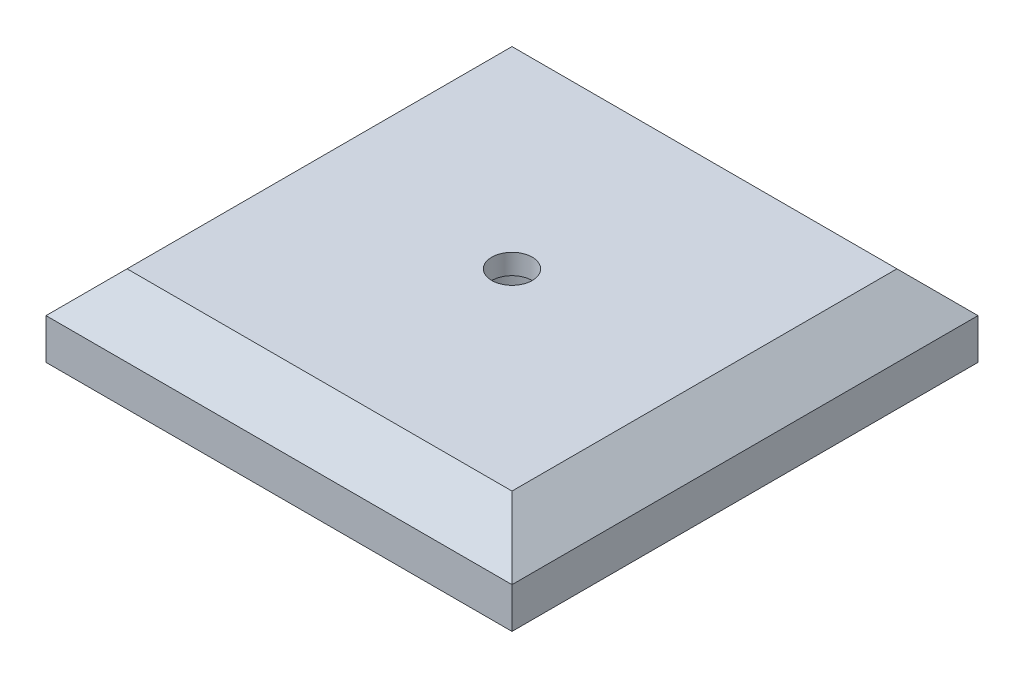
from build123d import *

# Parameters (mm, degrees)
SKETCH1_W           = 2.875
SKETCH1_H           = 2.875
BOSS_EXTRUDE1_DEPTH = 0.5
SKETCH4_R           = 0.252718066
CUT_EXTRUDE2_DEPTH  = 0.375
SKETCH6_R           = 0.125
CUT_EXTRUDE3_DEPTH  = 0.125
CHAMFER1_SIZE       = 0.25
CHAMFER2_SIZE       = 0.25
CHAMFER3_SIZE       = 0.25
CHAMFER4_SIZE       = 0.25


with BuildPart() as part:
    # Sketch1 → Boss-Extrude1 (new body)
    with BuildSketch(Plane(origin=(0, 0, 0), x_dir=(1, 0, 0), z_dir=(0, 1, 0))):
        Rectangle(SKETCH1_W, SKETCH1_H)
    extrude(amount=BOSS_EXTRUDE1_DEPTH)

    # Sketch4 → Cut-Extrude2 (cut)
    with BuildSketch(Plane(origin=(0, 0, 0), x_dir=(1, 0, 0), z_dir=(0, 1, 0))):
        with Locations(Location((0, 0, 0), (0, 0, 270))):
            Circle(SKETCH4_R)
    extrude(amount=CUT_EXTRUDE2_DEPTH, mode=Mode.SUBTRACT)

    # Sketch6 → Cut-Extrude3 (cut)
    with BuildSketch(Plane(origin=(0, 0.375, 0), x_dir=(1, 0, 0), z_dir=(0, 1, 0))):
        with Locations(Location((0, 0, 0), (0, 0, 270))):
            Circle(SKETCH6_R)
    extrude(amount=CUT_EXTRUDE3_DEPTH, mode=Mode.SUBTRACT)

    # Chamfer1
    chamfer1_edges = [part.edges().sort_by_distance(p)[0] for p in [
        (0, 0.5, 1.4375),
    ]]
    chamfer(chamfer1_edges, length=CHAMFER1_SIZE)

    # Chamfer2
    chamfer2_edges = [part.edges().sort_by_distance(p)[0] for p in [
        (1.4375, 0.5, -0.125),
    ]]
    chamfer(chamfer2_edges, length=CHAMFER2_SIZE)

    # Chamfer3
    chamfer3_edges = [part.edges().sort_by_distance(p)[0] for p in [
        (-0.125, 0.5, -1.4375),
    ]]
    chamfer(chamfer3_edges, length=CHAMFER3_SIZE)

    # Chamfer4
    chamfer4_edges = [part.edges().sort_by_distance(p)[0] for p in [
        (-1.4375, 0.5, 0),
    ]]
    chamfer(chamfer4_edges, length=CHAMFER4_SIZE)


solid = part.part
